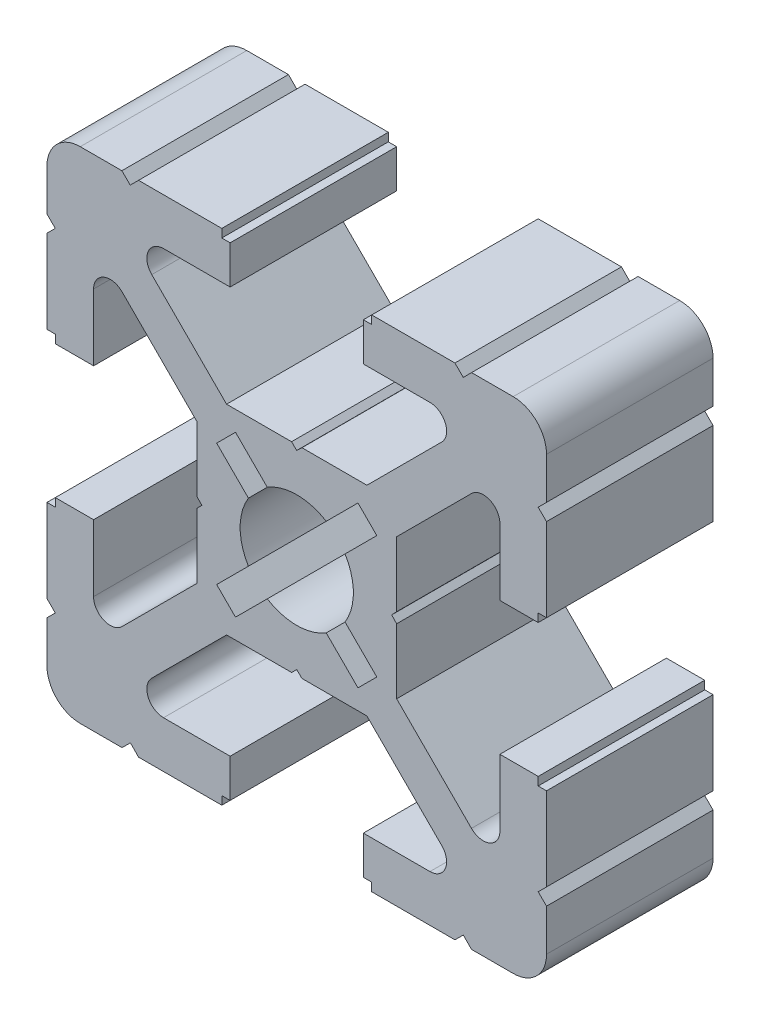
from build123d import *

# Parameters (mm, degrees)
BOSS_EXTRUDE1_DEPTH = 10


with BuildPart() as part:
    # Sketch1 → Boss-Extrude1 (new body)
    with BuildSketch(Plane.XY):
        with BuildLine():
            Line((12.999999999, 14.999999999), (10.499999999, 14.999999999))
            Line((10.499999999, 14.999999999), (9.999999999, 14.499999999))
            Line((9.999999999, 14.499999999), (9.5, 14.999999999))
            Line((9.5, 14.999999999), (4.5, 14.999999999))
            Line((4.5, 14.999999999), (4.5, 14.5))
            Line((4.5, 14.5), (4, 14.5))
            Line((4, 14.5), (4, 12.200000005))
            Line((4, 12.200000005), (7.999999994, 12.200000005))
            ThreePointArc((7.999999994, 12.200000005), (8.923879532, 11.582683434), (8.707106779, 10.492893215))
            Line((8.707106779, 10.492893215), (4.214213564, 6))
            Line((4.214213564, 6), (0.312520901, 6))
            Line((0.312520901, 6), (0, 5.7))
            Line((0, 5.7), (-0.312520903, 6))
            Line((-0.312520903, 6), (-4.214213564, 6))
            Line((-4.214213564, 6), (-8.70710678, 10.492893215))
            ThreePointArc((-8.70710678, 10.492893215), (-8.923879532, 11.582683434), (-7.999999995, 12.200000005))
            Line((-7.999999995, 12.200000005), (-4, 12.200000005))
            Line((-4, 12.200000005), (-4, 14.5))
            Line((-4, 14.5), (-4.5, 14.5))
            Line((-4.5, 14.5), (-4.5, 14.999999999))
            Line((-4.5, 14.999999999), (-9.500000003, 14.999999999))
            Line((-9.500000003, 14.999999999), (-10.000000002, 14.499999999))
            Line((-10.000000002, 14.499999999), (-10.500000001, 14.999999999))
            Line((-10.500000001, 14.999999999), (-13, 14.999999999))
            ThreePointArc((-13, 14.999999999), (-14.414213562, 14.414213561), (-15, 12.999999999))
            Line((-15, 12.999999999), (-15, 10.5))
            Line((-15, 10.5), (-14.500000001, 10.000000001))
            Line((-14.500000001, 10.000000001), (-15, 9.500000001))
            Line((-15, 9.500000001), (-15, 4.5))
            Line((-15, 4.5), (-14.5, 4.5))
            Line((-14.5, 4.5), (-14.5, 4))
            Line((-14.5, 4), (-12.200000005, 4))
            Line((-12.200000005, 4), (-12.200000005, 7.999999994))
            ThreePointArc((-12.200000005, 7.999999994), (-11.582683434, 8.923879532), (-10.492893215, 8.707106779))
            Line((-10.492893215, 8.707106779), (-6, 4.214213564))
            Line((-6, 4.214213564), (-6, 0.312520901))
            Line((-6, 0.312520901), (-5.7, 0))
            Line((-5.7, 0), (-6, -0.312520903))
            Line((-6, -0.312520903), (-6, -4.214213564))
            Line((-6, -4.214213564), (-10.492893215, -8.70710678))
            ThreePointArc((-10.492893215, -8.70710678), (-11.582683434, -8.923879532), (-12.200000005, -7.999999995))
            Line((-12.200000005, -7.999999995), (-12.200000005, -4))
            Line((-12.200000005, -4), (-14.5, -4))
            Line((-14.5, -4), (-14.5, -4.5))
            Line((-14.5, -4.5), (-15, -4.5))
            Line((-15, -4.5), (-15, -9.500000001))
            Line((-15, -9.500000001), (-14.500000001, -10.000000001))
            Line((-14.500000001, -10.000000001), (-15, -10.5))
            Line((-15, -10.5), (-15, -13))
            ThreePointArc((-15, -13), (-14.414213562, -14.414213562), (-13, -15))
            Line((-13, -15), (-10.489897949, -15))
            Line((-10.489897949, -15), (-9.989897949, -14.5))
            Line((-9.989897949, -14.5), (-9.500000001, -15))
            Line((-9.500000001, -15), (-4.5, -15))
            Line((-4.5, -15), (-4.5, -14.5))
            Line((-4.5, -14.5), (-4, -14.5))
            Line((-4, -14.5), (-4, -12.200000005))
            Line((-4, -12.200000005), (-7.999999995, -12.200000005))
            ThreePointArc((-7.999999995, -12.200000005), (-8.923879532, -11.582683434), (-8.70710678, -10.492893215))
            Line((-8.70710678, -10.492893215), (-4.214213564, -6))
            Line((-4.214213564, -6), (-0.312520901, -6))
            Line((-0.312520901, -6), (0, -5.7))
            Line((0, -5.7), (0.312520903, -6))
            Line((0.312520903, -6), (4.214213564, -6))
            Line((4.214213564, -6), (8.70710678, -10.492893215))
            ThreePointArc((8.70710678, -10.492893215), (8.923879532, -11.582683434), (7.999999995, -12.200000005))
            Line((7.999999995, -12.200000005), (4, -12.200000005))
            Line((4, -12.200000005), (4, -14.5))
            Line((4, -14.5), (4.5, -14.5))
            Line((4.5, -14.5), (4.5, -15))
            Line((4.5, -15), (9.500000001, -15))
            Line((9.500000001, -15), (10.000000001, -14.500000001))
            Line((10.000000001, -14.500000001), (10.5, -15))
            Line((10.5, -15), (12.999999999, -15))
            ThreePointArc((12.999999999, -15), (14.414213561, -14.414213562), (14.999999999, -13))
            Line((14.999999999, -13), (14.999999999, -10.500000001))
            Line((14.999999999, -10.500000001), (14.499999999, -10.000000002))
            Line((14.499999999, -10.000000002), (14.999999999, -9.500000002))
            Line((14.999999999, -9.500000002), (14.999999999, -4.5))
            Line((14.999999999, -4.5), (14.5, -4.5))
            Line((14.5, -4.5), (14.5, -4))
            Line((14.5, -4), (12.200000005, -4))
            Line((12.200000005, -4), (12.200000005, -7.999999995))
            ThreePointArc((12.200000005, -7.999999995), (11.582683434, -8.923879532), (10.492893215, -8.70710678))
            Line((10.492893215, -8.70710678), (6, -4.214213564))
            Line((6, -4.214213564), (6, -0.312520901))
            Line((6, -0.312520901), (5.7, 0))
            Line((5.7, 0), (6, 0.312520903))
            Line((6, 0.312520903), (6, 4.214213564))
            Line((6, 4.214213564), (10.492893215, 8.70710678))
            ThreePointArc((10.492893215, 8.70710678), (11.582683434, 8.923879532), (12.200000005, 7.999999995))
            Line((12.200000005, 7.999999995), (12.200000005, 4))
            Line((12.200000005, 4), (14.5, 4))
            Line((14.5, 4), (14.5, 4.5))
            Line((14.5, 4.5), (14.999999999, 4.5))
            Line((14.999999999, 4.5), (14.999999999, 9.5))
            Line((14.999999999, 9.5), (14.499999999, 9.999999999))
            Line((14.499999999, 9.999999999), (14.999999999, 10.499999999))
            Line((14.999999999, 10.499999999), (14.999999999, 12.999999999))
            ThreePointArc((14.999999999, 12.999999999), (14.414213561, 14.414213561), (12.999999999, 14.999999999))
        make_face()
        with BuildLine():
            Line((-2.902349714, 1.770978864), (-4.808326112, 3.676955262))
            Line((-4.808326112, 3.676955262), (-3.676955262, 4.808326112))
            Line((-3.676955262, 4.808326112), (-1.770978864, 2.902349714))
            ThreePointArc((-1.770978864, 2.902349714), (0, 3.4), (1.770978864, 2.902349714))
            Line((1.770978864, 2.902349714), (3.676955262, 4.808326112))
            Line((3.676955262, 4.808326112), (4.808326112, 3.676955262))
            Line((4.808326112, 3.676955262), (2.902349714, 1.770978864))
            ThreePointArc((2.902349714, 1.770978864), (3.4, 0), (2.902349714, -1.770978864))
            Line((2.902349714, -1.770978864), (4.808326112, -3.676955262))
            Line((4.808326112, -3.676955262), (3.676955262, -4.808326112))
            Line((3.676955262, -4.808326112), (1.770978864, -2.902349714))
            ThreePointArc((1.770978864, -2.902349714), (0, -3.4), (-1.770978864, -2.902349714))
            Line((-1.770978864, -2.902349714), (-3.676955262, -4.808326112))
            Line((-3.676955262, -4.808326112), (-4.808326112, -3.676955262))
            Line((-4.808326112, -3.676955262), (-2.902349714, -1.770978864))
            ThreePointArc((-2.902349714, -1.770978864), (-3.4, 0), (-2.902349714, 1.770978864))
        make_face(mode=Mode.SUBTRACT)
    extrude(amount=BOSS_EXTRUDE1_DEPTH)


solid = part.part
